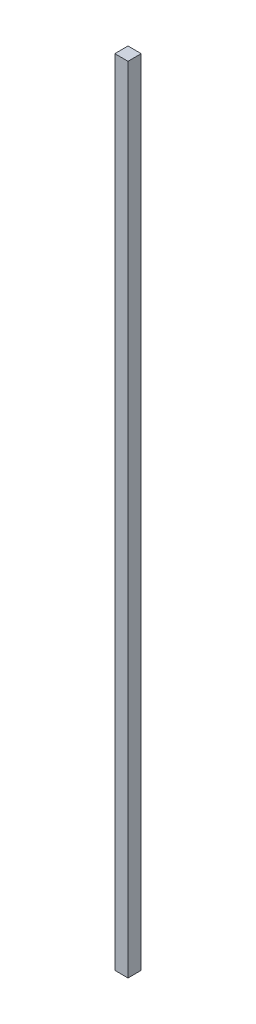
from build123d import *

# Parameters (mm, degrees)
SKETCH1_W           = 25.4
SKETCH1_H           = 25.4
BOSS_EXTRUDE1_DEPTH = 1524


with BuildPart() as part:
    # Sketch1 → Boss-Extrude1 (new body)
    with BuildSketch(Plane(origin=(0, 0, 0), x_dir=(1, 0, 0), z_dir=(0, 1, 0))):
        with Locations((12.7, -12.7)):
            Rectangle(SKETCH1_W, SKETCH1_H)
    extrude(amount=BOSS_EXTRUDE1_DEPTH)


solid = part.part
